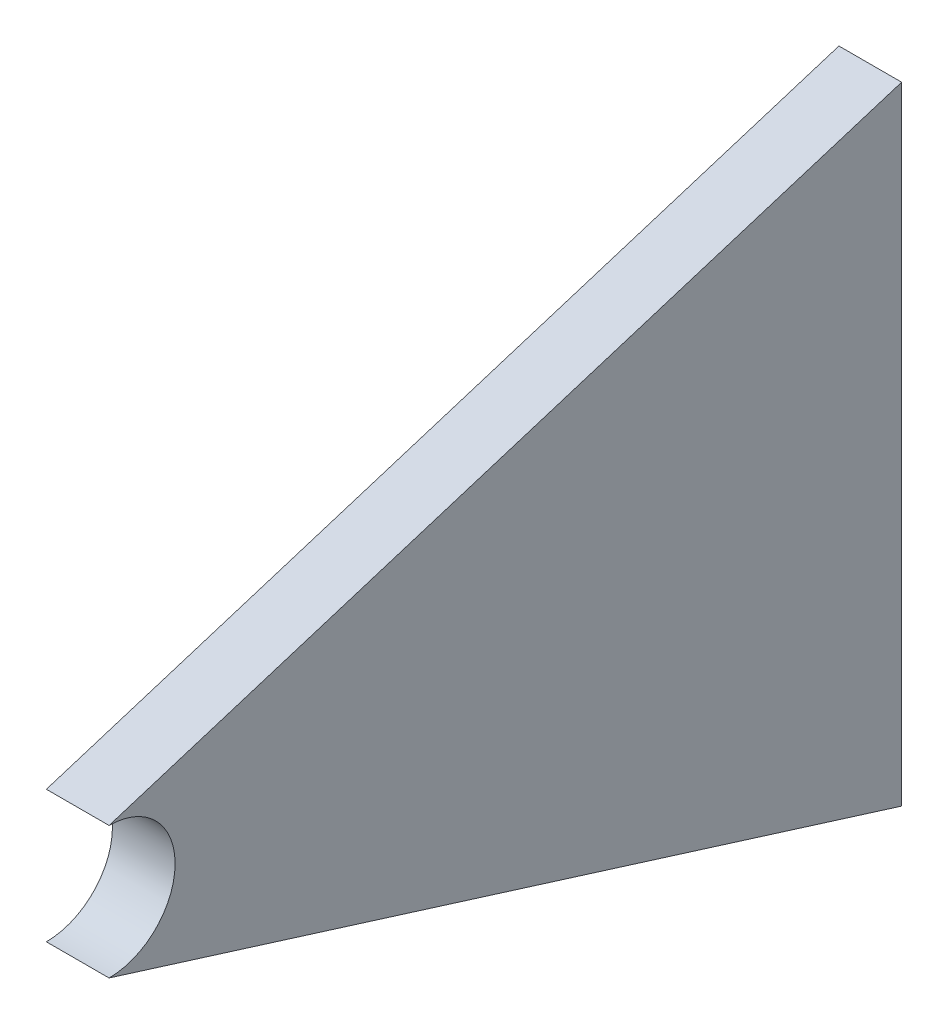
from build123d import *

# Parameters (mm, degrees)
BOSS_EXTRUDE1_DEPTH = 10


with BuildPart() as part:
    # Sketch1 → Boss-Extrude1 (new body)
    with BuildSketch(Plane.YZ):
        with BuildLine():
            Line((50, -26.725391492), (-50, -26.725391492))
            Line((-50, -26.725391492), (-10.534926176, 99.693722622))
            ThreePointArc((-10.534926176, 99.693722622), (0, 89.158796446), (10.534926176, 99.693722622))
            Line((10.534926176, 99.693722622), (50, -26.725391492))
        make_face()
    extrude(amount=BOSS_EXTRUDE1_DEPTH)


solid = part.part
